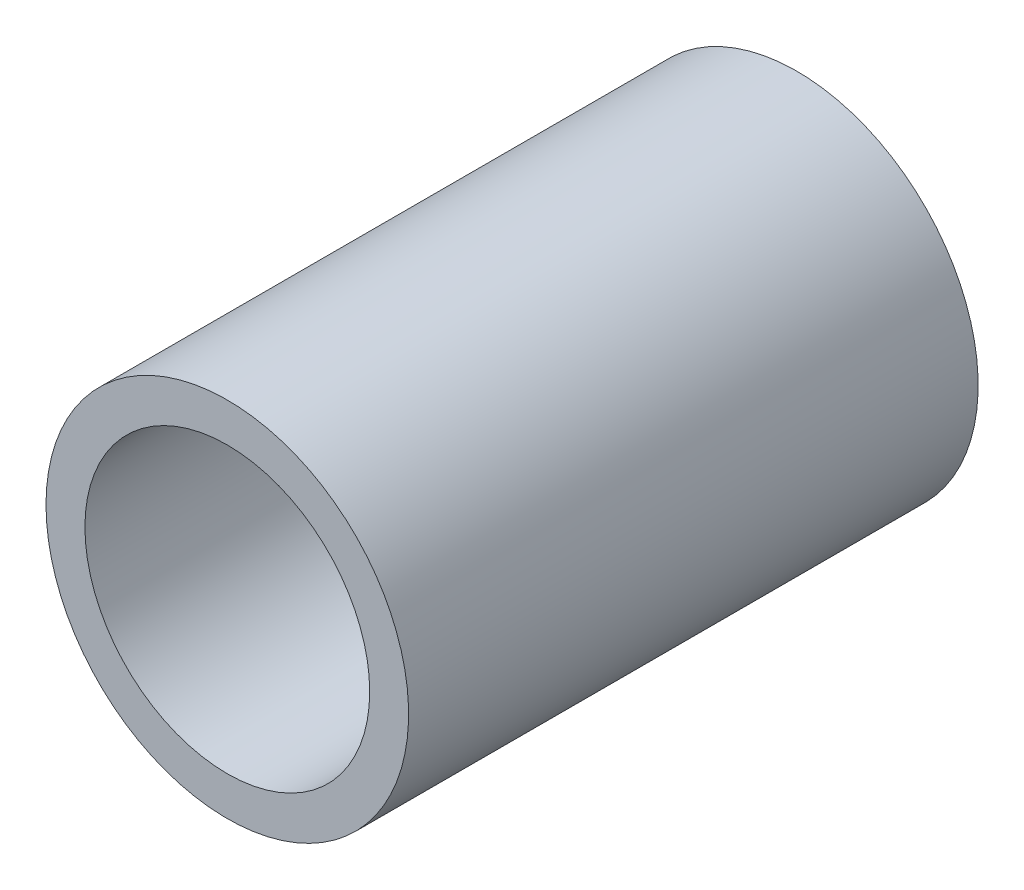
from build123d import *

# Parameters (mm, degrees)
SKETCH1_R           = 24.257
SKETCH1_R_2         = 19.05
BOSS_EXTRUDE1_DEPTH = 76.2


with BuildPart() as part:
    # Sketch1 → Boss-Extrude1 (new body)
    with BuildSketch(Plane.XY):
        with Locations(Location((0, 0, 0), (0, 0, 180))):
            Circle(SKETCH1_R)
        with Locations(Location((0, 0, 0), (0, 0, 180))):
            Circle(SKETCH1_R_2, mode=Mode.SUBTRACT)
    extrude(amount=BOSS_EXTRUDE1_DEPTH)


solid = part.part
